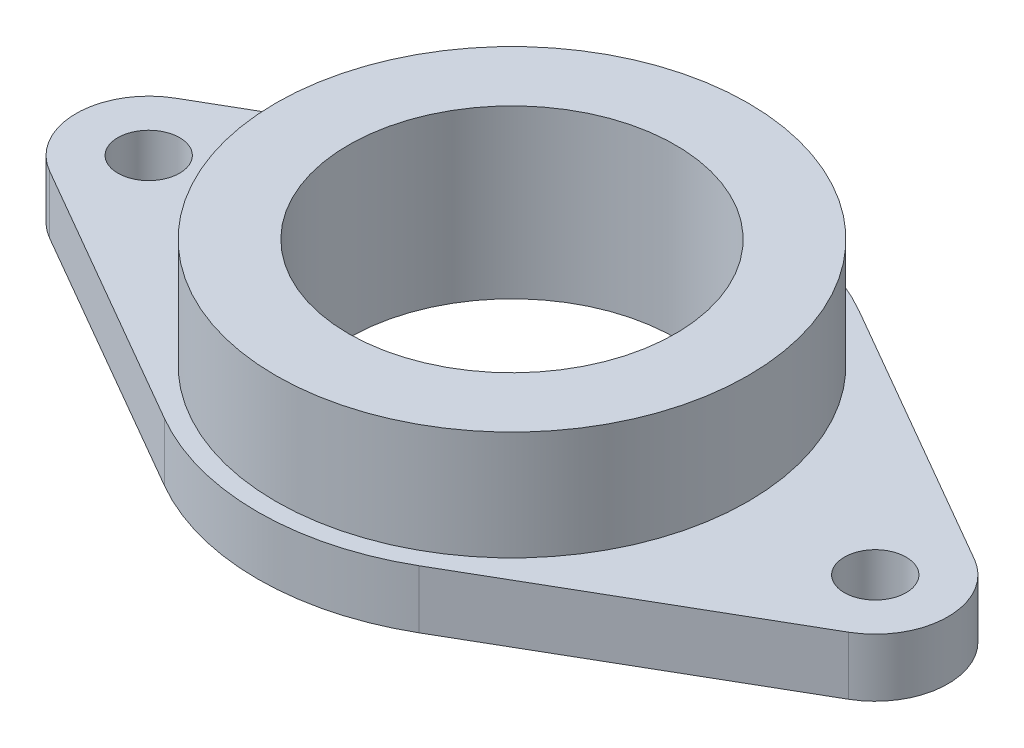
from build123d import *

# Parameters (mm, degrees)
SKETCH1_R           = 4.25
SKETCH1_R_2         = 22.5
BOSS_EXTRUDE1_DEPTH = 23
SKETCH2_OUTSIDE_W   = 150.164
SKETCH2_OUTSIDE_H   = 100.164
SKETCH2_OUTSIDE_R   = 32.5
CUT_EXTRUDE1_DEPTH  = 15


with BuildPart() as part:
    # Sketch1 → Boss-Extrude1 (new body)
    with BuildSketch(Plane(origin=(0, 0, 0), x_dir=(1, 0, 0), z_dir=(0, 1, 0))):
        with BuildLine():
            Line((-55, 8.660254038), (-17.5, 30.310889132))
            ThreePointArc((-17.5, 30.310889132), (0, 35), (17.5, 30.310889132))
            Line((17.5, 30.310889132), (55, 8.660254038))
            ThreePointArc((55, 8.660254038), (60, 0), (55, -8.660254038))
            Line((55, -8.660254038), (17.5, -30.310889132))
            ThreePointArc((17.5, -30.310889132), (0, -35), (-17.5, -30.310889132))
            Line((-17.5, -30.310889132), (-55, -8.660254038))
            ThreePointArc((-55, -8.660254038), (-60, 0), (-55, 8.660254038))
        make_face()
        with Locations(Location((-50, 0, 0), (0, 0, 270))):
            Circle(SKETCH1_R, mode=Mode.SUBTRACT)
        with Locations(Location((50, 0, 0), (0, 0, 90))):
            Circle(SKETCH1_R, mode=Mode.SUBTRACT)
        with Locations(Location((0, 0, 0), (0, 0, 270))):
            Circle(SKETCH1_R_2, mode=Mode.SUBTRACT)
    extrude(amount=BOSS_EXTRUDE1_DEPTH)

    # Sketch2 outside → Cut-Extrude1 (cut)
    with BuildSketch(Plane(origin=(0, 23, 0), x_dir=(1, 0, 0), z_dir=(0, 1, 0))):
        Rectangle(SKETCH2_OUTSIDE_W, SKETCH2_OUTSIDE_H)
        with Locations(Location((0, 0, 0), (0, 0, 270))):
            Circle(SKETCH2_OUTSIDE_R, mode=Mode.SUBTRACT)
    extrude(amount=-CUT_EXTRUDE1_DEPTH, mode=Mode.SUBTRACT)


solid = part.part
